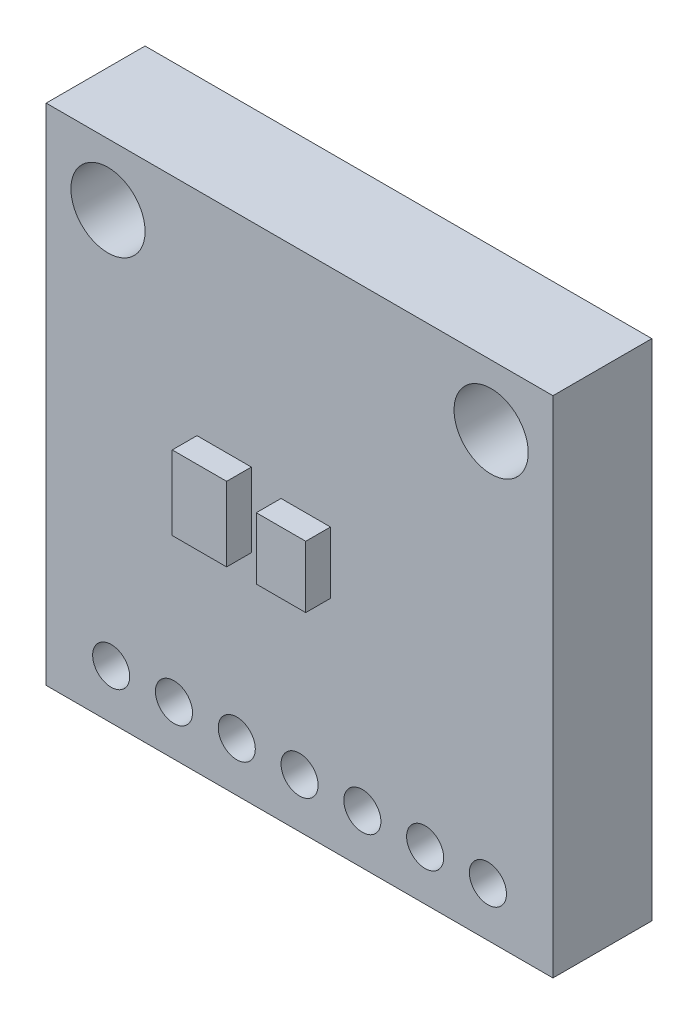
from build123d import *

# Parameters (mm, degrees)
ESQUISSE2_W             = 20.5
ESQUISSE2_H             = 20.4
BOSS_EXTRU_1_DEPTH      = 4
ESQUISSE3_R             = 1.5
ESQUISSE3_R_2           = 0.75
ENL_V_MAT_EXTRU_1_DEPTH = 30.196061378
ESQUISSE4_W             = 2.2
ESQUISSE4_H             = 3
BOSS_EXTRU_2_DEPTH      = 1
ESQUISSE4_W_2           = 2
ESQUISSE4_H_2           = 2.5
BOSS_EXTRU_2_2_DEPTH    = 1


with BuildPart() as part:
    # Esquisse2 → Boss.-Extru.1 (new body)
    with BuildSketch(Plane.XY):
        with Locations((10.25, 10.2)):
            Rectangle(ESQUISSE2_W, ESQUISSE2_H)
    extrude(amount=-BOSS_EXTRU_1_DEPTH)

    # Esquisse3 → Enlèv. mat.-Extru.1 (cut, through all)
    with BuildSketch(Plane.XY):
        with Locations((2.5, 17.9)):
            Circle(ESQUISSE3_R)
        with Locations((18, 17.9)):
            Circle(ESQUISSE3_R)
        with Locations((2.63, 2)):
            Circle(ESQUISSE3_R_2)
        with Locations((5.17, 2)):
            Circle(ESQUISSE3_R_2)
        with Locations((7.71, 2)):
            Circle(ESQUISSE3_R_2)
        with Locations((10.25, 2)):
            Circle(ESQUISSE3_R_2)
        with Locations((12.79, 2)):
            Circle(ESQUISSE3_R_2)
        with Locations((15.33, 2)):
            Circle(ESQUISSE3_R_2)
        with Locations((17.87, 2)):
            Circle(ESQUISSE3_R_2)
    extrude(amount=-ENL_V_MAT_EXTRU_1_DEPTH, mode=Mode.SUBTRACT)


with BuildPart() as body_2:
    # Esquisse4 → Boss.-Extru.2 (new body)
    with BuildSketch(Plane.XY):
        with Locations((7.2, 10.3)):
            Rectangle(ESQUISSE4_W, ESQUISSE4_H)
    extrude(amount=BOSS_EXTRU_2_DEPTH)


with BuildPart() as body_3:
    # Esquisse4 → Boss.-Extru.2 2 (new body)
    with BuildSketch(Plane.XY):
        with Locations((10.5, 10.05)):
            Rectangle(ESQUISSE4_W_2, ESQUISSE4_H_2)
    extrude(amount=BOSS_EXTRU_2_2_DEPTH)


solid = Compound([part.part, body_2.part, body_3.part])
